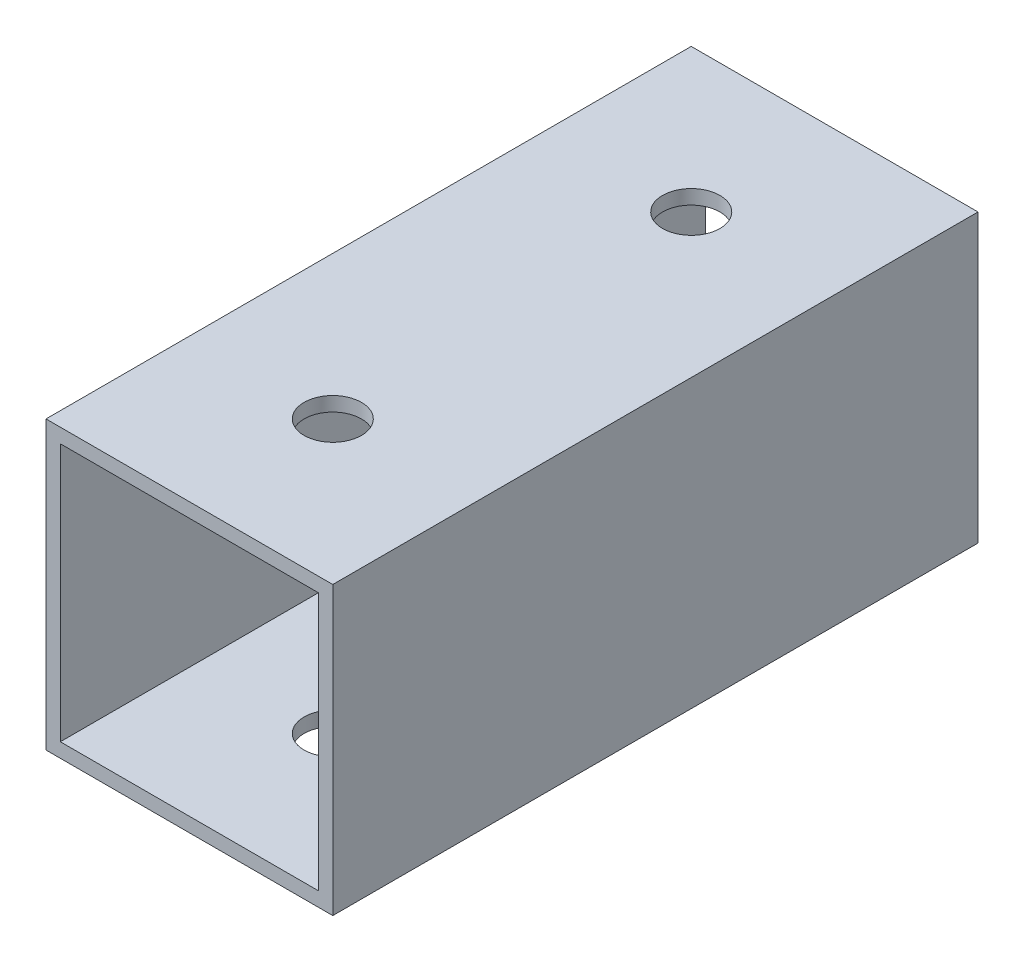
from build123d import *

# Parameters (mm, degrees)
SKETCH_1_W          = 20
SKETCH_1_H          = 20
SKETCH_1_W_2        = 18
SKETCH_1_H_2        = 18
EXTRUDE_1_DEPTH     = 45
CUT_EXTRUDE_1_REACH = 52.249
SKETCH_2_R          = 2


with BuildPart() as part:
    # 草图1 → 凸台-拉伸1 (new body)
    with BuildSketch(Plane.XY):
        Rectangle(SKETCH_1_W, SKETCH_1_H)
        Rectangle(SKETCH_1_W_2, SKETCH_1_H_2, mode=Mode.SUBTRACT)
    extrude(amount=EXTRUDE_1_DEPTH)

    # 切除-拉伸1: up to this face of the body (flat: up to its plane)
    cut_extrude_1_end = Plane(part.part.faces().sort_by_distance((0, -10, 22.5))[0])
    # 草图2 → 切除-拉伸1 (cut, up to the picked face)
    with BuildSketch(Plane(origin=(0, 10, 0), x_dir=(1, 0, 0), z_dir=(0, 1, 0)), mode=Mode.PRIVATE) as cut_extrude_1_sk1:
        with Locations(Location((0, -10, 0), (0, 0, 270))):
            Circle(SKETCH_2_R)
    cut_extrude_1_tool1 = split(extrude(cut_extrude_1_sk1.sketch, amount=-CUT_EXTRUDE_1_REACH, mode=Mode.PRIVATE), bisect_by=cut_extrude_1_end, keep=Keep.BOTH, mode=Mode.PRIVATE)
    # 草图2 → 切除-拉伸1 (cut, up to the picked face)
    with BuildSketch(Plane(origin=(0, 10, 0), x_dir=(1, 0, 0), z_dir=(0, 1, 0)), mode=Mode.PRIVATE) as cut_extrude_1_sk2:
        with Locations(Location((0, -35, 0), (0, 0, 270))):
            Circle(SKETCH_2_R)
    cut_extrude_1_tool2 = split(extrude(cut_extrude_1_sk2.sketch, amount=-CUT_EXTRUDE_1_REACH, mode=Mode.PRIVATE), bisect_by=cut_extrude_1_end, keep=Keep.BOTH, mode=Mode.PRIVATE)
    add(cut_extrude_1_tool1.solids().sort_by(Axis((0, 10, 10), (0, -1, 0)))[0], mode=Mode.SUBTRACT)
    add(cut_extrude_1_tool2.solids().sort_by(Axis((0, 10, 35), (0, -1, 0)))[0], mode=Mode.SUBTRACT)


solid = part.part
